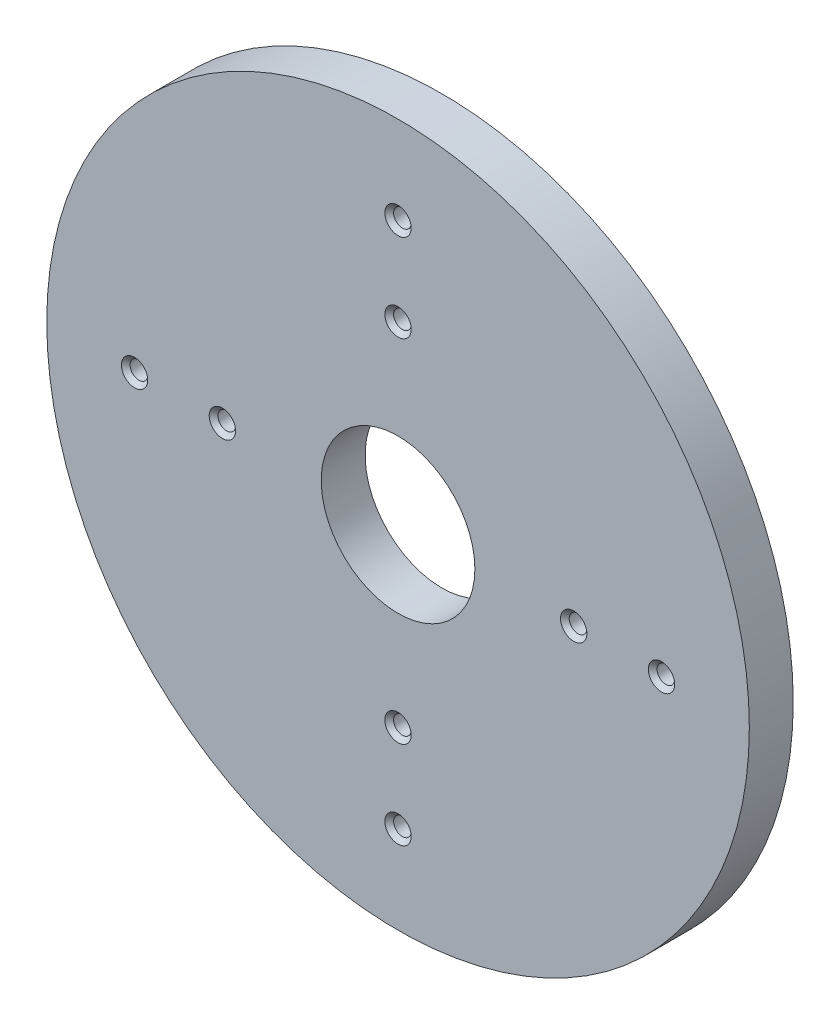
from build123d import *

# Parameters (mm, degrees)
SKETCH1_R                        = 101.6
SKETCH1_R_2                      = 22.225
BOSS_EXTRUDE1_DEPTH              = 12.7
F_1_4_20_TAPPED_HOLE1_AT_2_COUNT = 2
F_1_4_20_TAPPED_HOLE1_AT_2_PITCH = 91.581002397
F_1_4_20_TAPPED_HOLE1_AT_3_COUNT = 2
F_1_4_20_TAPPED_HOLE1_AT_3_PITCH = 71.842048969
F_1_4_20_TAPPED_HOLE1_AT_4_COUNT = 2
F_1_4_20_TAPPED_HOLE1_AT_4_PITCH = 127
F_1_4_20_TAPPED_HOLE1_AT_5_COUNT = 2
F_1_4_20_TAPPED_HOLE1_AT_5_PITCH = 101.6
F_1_4_20_TAPPED_HOLE1_AT_6_COUNT = 2
F_1_4_20_TAPPED_HOLE1_AT_6_PITCH = 91.581002397
F_1_4_20_TAPPED_HOLE1_AT_7_COUNT = 2
F_1_4_20_TAPPED_HOLE1_AT_7_PITCH = 71.842048969
F_1_4_20_TAPPED_HOLE1_AT_8_COUNT = 2
F_1_4_20_TAPPED_HOLE1_AT_8_PITCH = 25.4


with BuildPart() as part:
    # Sketch1 → Boss-Extrude1 (new body)
    with BuildSketch(Plane.XY):
        Circle(SKETCH1_R)
        Circle(SKETCH1_R_2, mode=Mode.SUBTRACT)
    extrude(amount=BOSS_EXTRUDE1_DEPTH)

    # Sketch3 → 1/4-20 Tapped Hole1 (revolve, cut)
    with BuildSketch(Plane(origin=(-50.8, 0, 12.7), x_dir=(0, -1, 0), z_dir=(1, 0, 0))):
        Polygon((0, 0), (0, 12.7), (3.81, 12.7), (2.5527, 11.4427), (2.5527, 1.2573), (3.81, 0), align=None)
    f_1_4_20_tapped_hole1 = revolve(axis=Axis((-50.8, 0, 19.05), (0, 0, -1)), mode=Mode.SUBTRACT)

    # 1/4-20 Tapped Hole1 at 2: 1/4-20 Tapped Hole1 ×2
    with Locations(*[Vector(0.554700196225211, 0.8320502943378558, 0) * (i * F_1_4_20_TAPPED_HOLE1_AT_2_PITCH) for i in range(1, F_1_4_20_TAPPED_HOLE1_AT_2_COUNT)]):
        add(f_1_4_20_tapped_hole1, mode=Mode.SUBTRACT)

    # 1/4-20 Tapped Hole1 at 3: 1/4-20 Tapped Hole1 ×2
    with Locations(*[Vector(0.7071067811865276, 0.7071067811865674, 0) * (i * F_1_4_20_TAPPED_HOLE1_AT_3_PITCH) for i in range(1, F_1_4_20_TAPPED_HOLE1_AT_3_COUNT)]):
        add(f_1_4_20_tapped_hole1, mode=Mode.SUBTRACT)

    # 1/4-20 Tapped Hole1 at 4: 1/4-20 Tapped Hole1 ×2
    with Locations(*[(i * F_1_4_20_TAPPED_HOLE1_AT_4_PITCH, 0, 0) for i in range(1, F_1_4_20_TAPPED_HOLE1_AT_4_COUNT)]):
        add(f_1_4_20_tapped_hole1, mode=Mode.SUBTRACT)

    # 1/4-20 Tapped Hole1 at 5: 1/4-20 Tapped Hole1 ×2
    with Locations(*[(i * F_1_4_20_TAPPED_HOLE1_AT_5_PITCH, 0, 0) for i in range(1, F_1_4_20_TAPPED_HOLE1_AT_5_COUNT)]):
        add(f_1_4_20_tapped_hole1, mode=Mode.SUBTRACT)

    # 1/4-20 Tapped Hole1 at 6: 1/4-20 Tapped Hole1 ×2
    with Locations(*[Vector(0.5547001962252472, -0.8320502943378317, 0) * (i * F_1_4_20_TAPPED_HOLE1_AT_6_PITCH) for i in range(1, F_1_4_20_TAPPED_HOLE1_AT_6_COUNT)]):
        add(f_1_4_20_tapped_hole1, mode=Mode.SUBTRACT)

    # 1/4-20 Tapped Hole1 at 7: 1/4-20 Tapped Hole1 ×2
    with Locations(*[Vector(0.7071067811865674, -0.7071067811865276, 0) * (i * F_1_4_20_TAPPED_HOLE1_AT_7_PITCH) for i in range(1, F_1_4_20_TAPPED_HOLE1_AT_7_COUNT)]):
        add(f_1_4_20_tapped_hole1, mode=Mode.SUBTRACT)

    # 1/4-20 Tapped Hole1 at 8: 1/4-20 Tapped Hole1 ×2
    with Locations(*[(-i * F_1_4_20_TAPPED_HOLE1_AT_8_PITCH, 0, 0) for i in range(1, F_1_4_20_TAPPED_HOLE1_AT_8_COUNT)]):
        add(f_1_4_20_tapped_hole1, mode=Mode.SUBTRACT)


solid = part.part
